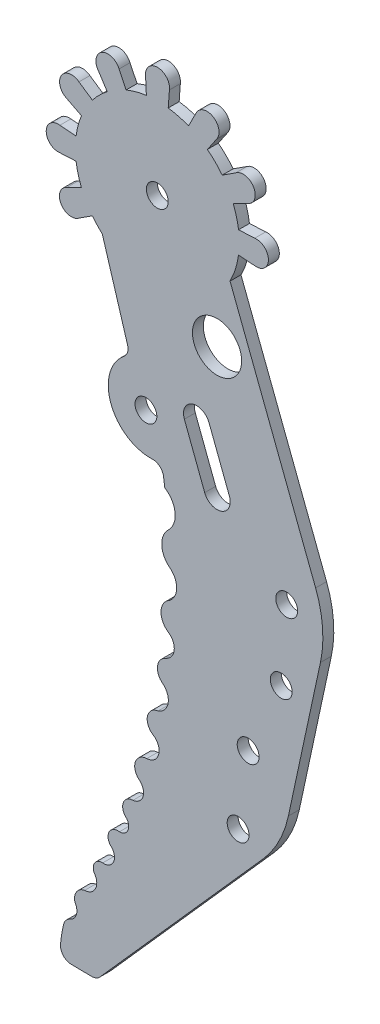
from build123d import *

# Parameters (mm, degrees)
SKETCH1_R           = 1
SKETCH1_R_2         = 2.25
SKETCH1_R_3         = 0.998074624
BOSS_EXTRUDE1_DEPTH = 1


with BuildPart() as part:
    # Sketch1 → Boss-Extrude1 (new body)
    with BuildSketch(Plane.XY):
        with BuildLine():
            Line((2.730147947, 1), (1.25, 1.108078099))
            ThreePointArc((1.25, 1.108078099), (-0.000138167, 0.017440541), (1.25, -1.073197017))
            Line((1.25, -1.073197017), (2.730147947, -1))
            ThreePointArc((2.730147947, -1), (2.918738623, -1.941142838), (3.225985726, -2.850491783))
            Line((3.225985726, -2.850491783), (1.890100953, -3.496967377))
            ThreePointArc((1.890100953, -3.496967377), (1.352768321, -5.066556292), (2.980738511, -5.38600704))
            Line((2.980738511, -5.38600704), (4.225985726, -4.582542591))
            ThreePointArc((4.225985726, -4.582542591), (4.656981948, -5.092323385), (5.131600413, -5.561760829))
            Line((5.131600413, -5.561760829), (7.44171219, -13.199988708))
            ThreePointArc((7.44171219, -13.199988708), (7.439945119, -13.784749424), (7.111476001, -14.268543034))
            ThreePointArc((7.111476001, -14.268543034), (5.923924571, -18.62818009), (9.697794763, -21.113057841))
            ThreePointArc((9.697794763, -21.113057841), (10.380528535, -21.341854349), (10.732574986, -21.969975788))
            ThreePointArc((10.732574986, -21.969975788), (10.791766979, -22.393908793), (10.847713449, -22.818282305))
            ThreePointArc((10.847713449, -22.818282305), (11.790244876, -24.335347863), (11.16321594, -26.007678007))
            ThreePointArc((11.16321594, -26.007678007), (10.570290463, -27.483765064), (11.290805177, -28.901951288))
            ThreePointArc((11.290805177, -28.901951288), (11.931562756, -30.214937196), (11.277042334, -31.52111685))
            ThreePointArc((11.277042334, -31.52111685), (10.500432467, -32.761716535), (11.145287395, -34.075631519))
            ThreePointArc((11.145287395, -34.075631519), (11.711049486, -35.240414102), (10.937199745, -36.278663489))
            ThreePointArc((10.937199745, -36.278663489), (10.185540032, -37.265502357), (10.650830557, -38.415436269))
            ThreePointArc((10.650830557, -38.415436269), (11.153884573, -39.735845823), (10.230304321, -40.805212107))
            ThreePointArc((10.230304321, -40.805212107), (9.263580844, -41.700908083), (9.768401259, -42.918274877))
            ThreePointArc((9.768401259, -42.918274877), (10.29278617, -44.215864041), (9.202326649, -45.093141196))
            ThreePointArc((9.202326649, -45.093141196), (8.144843355, -45.909982105), (8.571180325, -47.176369398))
            ThreePointArc((8.571180325, -47.176369398), (8.845608938, -48.309992252), (7.932024848, -49.035096348))
            ThreePointArc((7.932024848, -49.035096348), (7.054134874, -49.652663659), (7.297145805, -50.698142438))
            ThreePointArc((7.297145805, -50.698142438), (7.486031135, -51.627523472), (6.693279806, -52.148073283))
            ThreePointArc((6.693279806, -52.148073283), (5.736341709, -52.667939714), (5.979078831, -53.729575393))
            ThreePointArc((5.979078831, -53.729575393), (6.146574337, -54.831276595), (5.172832259, -55.373149872))
            ThreePointArc((5.172832259, -55.373149872), (4.397991341, -55.805643097), (4.477975588, -56.689402883))
            ThreePointArc((4.477975588, -56.689402883), (4.477842946, -57.805544451), (3.519463877, -58.377629741))
            ThreePointArc((3.519463877, -58.377629741), (2.763689302, -58.882818754), (2.639049746, -59.78330536))
            ThreePointArc((2.639049746, -59.78330536), (2.762025793, -60.669472955), (2.167842085, -61.338324084))
            ThreePointArc((2.167842085, -61.338324084), (1.802507902, -61.611764905), (1.596700522, -62.019051378))
            ThreePointArc((1.596700522, -62.019051378), (1.419841706, -62.882777694), (1.305095034, -63.756926075))
            ThreePointArc((1.305095034, -63.756926075), (1.556005476, -64.519090759), (2.286327304, -64.851477705))
            Line((2.286327304, -64.851477705), (4.151796088, -64.878115588))
            ThreePointArc((4.151796088, -64.878115588), (4.56955608, -64.79320511), (4.913989999, -64.54201101))
            Line((4.913989999, -64.54201101), (19.858030846, -47.704114694))
            ThreePointArc((19.858030846, -47.704114694), (21.299586827, -45.585122466), (22.155211357, -43.169316519))
            Line((22.155211357, -43.169316519), (25.087470282, -29.538838187))
            ThreePointArc((25.087470282, -29.538838187), (25.281255234, -26.663292069), (24.646889926, -23.851904734))
            Line((24.646889926, -23.851904734), (16.818242905, -3.45834767))
            ThreePointArc((16.818242905, -3.45834767), (17.313669941, -2.262858102), (17.596216694, -1))
            Line((17.596216694, -1), (19.076364641, -1.108078099))
            ThreePointArc((19.076364641, -1.108078099), (20.326502808, -0.017440541), (19.076364641, 1.073197017))
            Line((19.076364641, 1.073197017), (17.596216694, 1))
            ThreePointArc((17.596216694, 1), (17.407626018, 1.941142838), (17.100378915, 2.850491783))
            Line((17.100378915, 2.850491783), (18.436263688, 3.496967377))
            ThreePointArc((18.436263688, 3.496967377), (18.97359632, 5.066556292), (17.34562613, 5.38600704))
            Line((17.34562613, 5.38600704), (16.100378915, 4.582542591))
            ThreePointArc((16.100378915, 4.582542591), (15.466483179, 5.303300859), (14.745724911, 5.937196595))
            Line((14.745724911, 5.937196595), (15.579397264, 7.165003268))
            ThreePointArc((15.579397264, 7.165003268), (15.259946516, 8.792973458), (13.690357601, 8.255640826))
            Line((13.690357601, 8.255640826), (13.013674103, 6.937196595))
            ThreePointArc((13.013674103, 6.937196595), (12.104325159, 7.244443697), (11.16318232, 7.433034374))
            Line((11.16318232, 7.433034374), (11.27126042, 8.91318232))
            ThreePointArc((11.27126042, 8.91318232), (10.180622862, 10.163320487), (9.089985304, 8.91318232))
            Line((9.089985304, 8.91318232), (9.16318232, 7.433034374))
            ThreePointArc((9.16318232, 7.433034374), (8.222039482, 7.244443697), (7.312690537, 6.937196595))
            Line((7.312690537, 6.937196595), (6.666214944, 8.273081368))
            ThreePointArc((6.666214944, 8.273081368), (5.096626029, 8.810413999), (4.77717528, 7.18244381))
            Line((4.77717528, 7.18244381), (5.58063973, 5.937196595))
            ThreePointArc((5.58063973, 5.937196595), (4.859881461, 5.303300859), (4.225985726, 4.582542591))
            Line((4.225985726, 4.582542591), (2.998179052, 5.416214944))
            ThreePointArc((2.998179052, 5.416214944), (1.370208862, 5.096764195), (1.907541494, 3.52717528))
            Line((1.907541494, 3.52717528), (3.225985726, 2.850491783))
            ThreePointArc((3.225985726, 2.850491783), (2.918738623, 1.941142838), (2.730147947, 1))
        make_face()
        with Locations((10.16318232, 0)):
            Circle(SKETCH1_R, mode=Mode.SUBTRACT)
        with Locations((15.627966379, -9.260281964)):
            Circle(SKETCH1_R_2, mode=Mode.SUBTRACT)
        with Locations((9.121782476, -17.526259213)):
            Circle(SKETCH1_R_3, mode=Mode.SUBTRACT)
        with Locations((22, -26.49969455)):
            Circle(SKETCH1_R, mode=Mode.SUBTRACT)
        with Locations((21.500000045, -33.166361217)):
            Circle(SKETCH1_R, mode=Mode.SUBTRACT)
        with Locations((18.474150388, -39.833027883)):
            Circle(SKETCH1_R, mode=Mode.SUBTRACT)
        with Locations((17.55481685, -46.49969455)):
            Circle(SKETCH1_R, mode=Mode.SUBTRACT)
        with BuildLine():
            Line((14.500290742, -21.375988683), (12.638736062, -16.487053928))
            ThreePointArc((12.638736062, -16.487053928), (13.337027802, -14.929994394), (14.894087335, -15.628286133))
            Line((14.894087335, -15.628286133), (16.755642015, -20.517220889))
            ThreePointArc((16.755642015, -20.517220889), (16.057350276, -22.074280422), (14.500290742, -21.375988683))
        make_face(mode=Mode.SUBTRACT)
    extrude(amount=BOSS_EXTRUDE1_DEPTH)


solid = part.part
